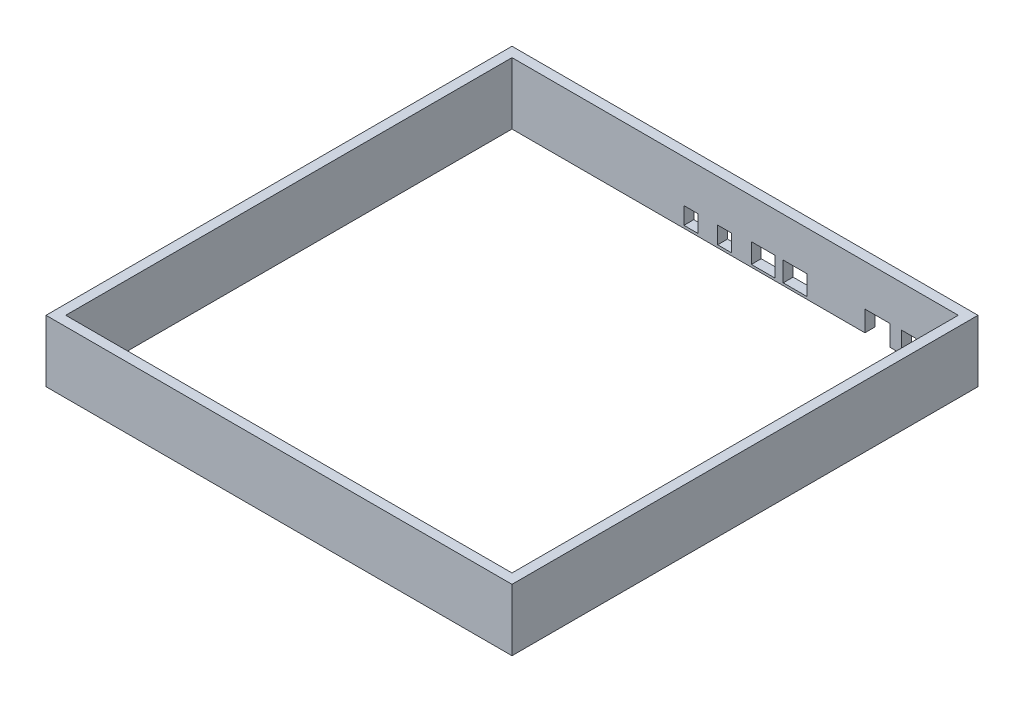
from build123d import *

# Parameters (mm, degrees)
SKETCH1_W           = 300
SKETCH1_H           = 300
SKETCH1_W_2         = 287.3
SKETCH1_H_2         = 287.3
BOSS_EXTRUDE1_DEPTH = 39.8272
CUT_EXTRUDE1_REACH  = 339.766
SKETCH3_W           = 9.414604459
SKETCH3_H           = 11.065164
SKETCH3_W_2         = 16.002
SKETCH3_H_2         = 13.335
SKETCH3_W_3         = 15.3
SKETCH3_H_3         = 12.7
SKETCH3_W_4         = 9
SKETCH3_H_4         = 11


with BuildPart() as part:
    # Sketch1 → Boss-Extrude1 (new body)
    with BuildSketch(Plane(origin=(0, 0, 0), x_dir=(1, 0, 0), z_dir=(0, 1, 0))):
        Rectangle(SKETCH1_W, SKETCH1_H)
        Rectangle(SKETCH1_W_2, SKETCH1_H_2, mode=Mode.SUBTRACT)
    extrude(amount=BOSS_EXTRUDE1_DEPTH)

    # Sketch3 → Cut-Extrude1 (cut, up to next)
    with BuildSketch(Plane(origin=(0, 0, -150), x_dir=(-1, 0, 0), z_dir=(0, 0, -1)), mode=Mode.PRIVATE) as cut_extrude1_sk1:
        with Locations((-111.859321897, 7.773371258)):
            Rectangle(SKETCH3_W, SKETCH3_H)
    cut_extrude1_tool1 = extrude(cut_extrude1_sk1.sketch, amount=-CUT_EXTRUDE1_REACH, mode=Mode.PRIVATE) & part.part
    # Sketch3 → Cut-Extrude1 (cut, up to next)
    with BuildSketch(Plane(origin=(0, 0, -150), x_dir=(-1, 0, 0), z_dir=(0, 0, -1)), mode=Mode.PRIVATE) as cut_extrude1_sk2:
        with Locations((-91.547624126, 6.5913)):
            Rectangle(SKETCH3_W_2, SKETCH3_H_2)
    cut_extrude1_tool2 = extrude(cut_extrude1_sk2.sketch, amount=-CUT_EXTRUDE1_REACH, mode=Mode.PRIVATE) & part.part
    # Sketch3 → Cut-Extrude1 (cut, up to next)
    with BuildSketch(Plane(origin=(0, 0, -150), x_dir=(-1, 0, 0), z_dir=(0, 0, -1)), mode=Mode.PRIVATE) as cut_extrude1_sk3:
        with Locations((-38.618448478, 7.9248)):
            Rectangle(SKETCH3_W_3, SKETCH3_H_3)
    cut_extrude1_tool3 = extrude(cut_extrude1_sk3.sketch, amount=-CUT_EXTRUDE1_REACH, mode=Mode.PRIVATE) & part.part
    # Sketch3 → Cut-Extrude1 (cut, up to next)
    with BuildSketch(Plane(origin=(0, 0, -150), x_dir=(-1, 0, 0), z_dir=(0, 0, -1)), mode=Mode.PRIVATE) as cut_extrude1_sk4:
        with Locations((-18.092571078, 7.9248)):
            Rectangle(SKETCH3_W_3, SKETCH3_H_3)
    cut_extrude1_tool4 = extrude(cut_extrude1_sk4.sketch, amount=-CUT_EXTRUDE1_REACH, mode=Mode.PRIVATE) & part.part
    # Sketch3 → Cut-Extrude1 (cut, up to next)
    with BuildSketch(Plane(origin=(0, 0, -150), x_dir=(-1, 0, 0), z_dir=(0, 0, -1)), mode=Mode.PRIVATE) as cut_extrude1_sk5:
        with Locations((6.757428922, 7.1748)):
            Rectangle(SKETCH3_W_4, SKETCH3_H_4)
    cut_extrude1_tool5 = extrude(cut_extrude1_sk5.sketch, amount=-CUT_EXTRUDE1_REACH, mode=Mode.PRIVATE) & part.part
    # Sketch3 → Cut-Extrude1 (cut, up to next)
    with BuildSketch(Plane(origin=(0, 0, -150), x_dir=(-1, 0, 0), z_dir=(0, 0, -1)), mode=Mode.PRIVATE) as cut_extrude1_sk6:
        with Locations((28.457428922, 7.1748)):
            Rectangle(SKETCH3_W_4, SKETCH3_H_4)
    cut_extrude1_tool6 = extrude(cut_extrude1_sk6.sketch, amount=-CUT_EXTRUDE1_REACH, mode=Mode.PRIVATE) & part.part
    add(cut_extrude1_tool1.solids().sort_by_distance((111.859322, 7.773371, -150))[0], mode=Mode.SUBTRACT)
    add(cut_extrude1_tool2.solids().sort_by_distance((91.547624, 6.5913, -150))[0], mode=Mode.SUBTRACT)
    add(cut_extrude1_tool3.solids().sort_by_distance((38.618448, 7.9248, -150))[0], mode=Mode.SUBTRACT)
    add(cut_extrude1_tool4.solids().sort_by_distance((18.092571, 7.9248, -150))[0], mode=Mode.SUBTRACT)
    add(cut_extrude1_tool5.solids().sort_by_distance((-6.757429, 7.1748, -150))[0], mode=Mode.SUBTRACT)
    add(cut_extrude1_tool6.solids().sort_by_distance((-28.457429, 7.1748, -150))[0], mode=Mode.SUBTRACT)


solid = part.part
